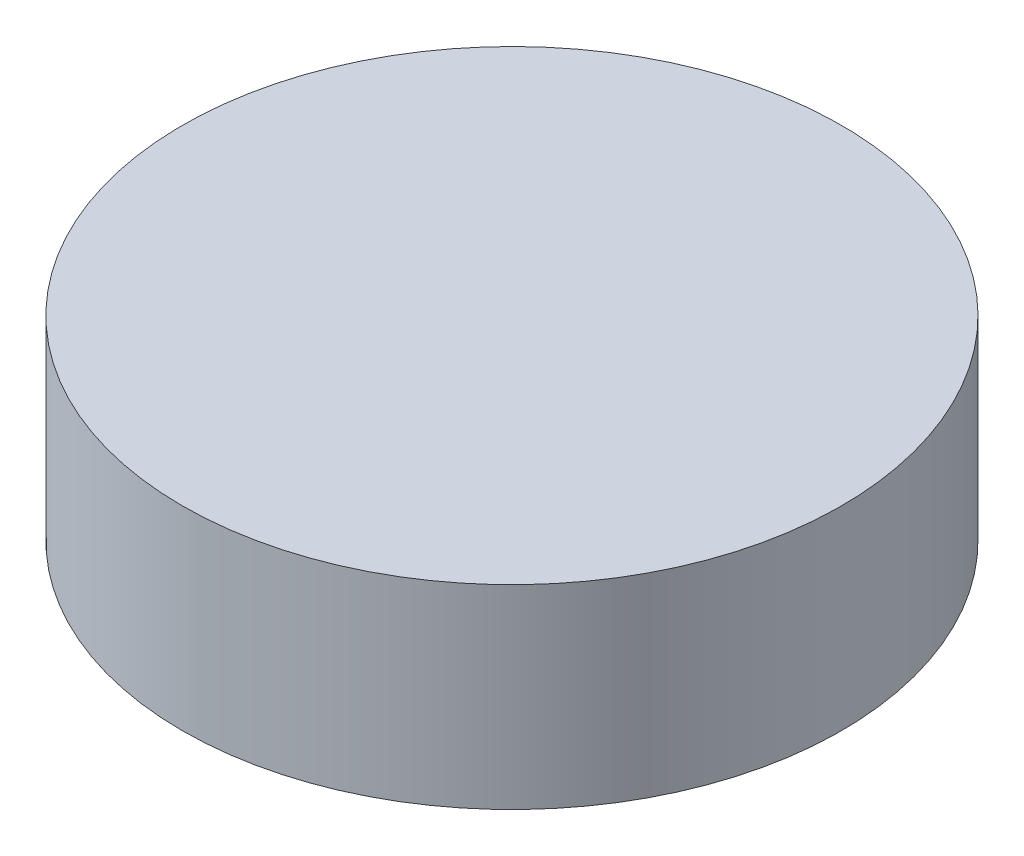
from build123d import *

# Parameters (mm, degrees)
SKETCH1_R           = 139.7
BOSS_EXTRUDE1_DEPTH = 82.55


with BuildPart() as part:
    # Sketch1 → Boss-Extrude1 (new body)
    with BuildSketch(Plane(origin=(0, 0, 0), x_dir=(1, 0, 0), z_dir=(0, 1, 0))):
        with Locations(Location((0, 0, 0), (0, 0, 270))):
            Circle(SKETCH1_R)
    extrude(amount=BOSS_EXTRUDE1_DEPTH)


solid = part.part
